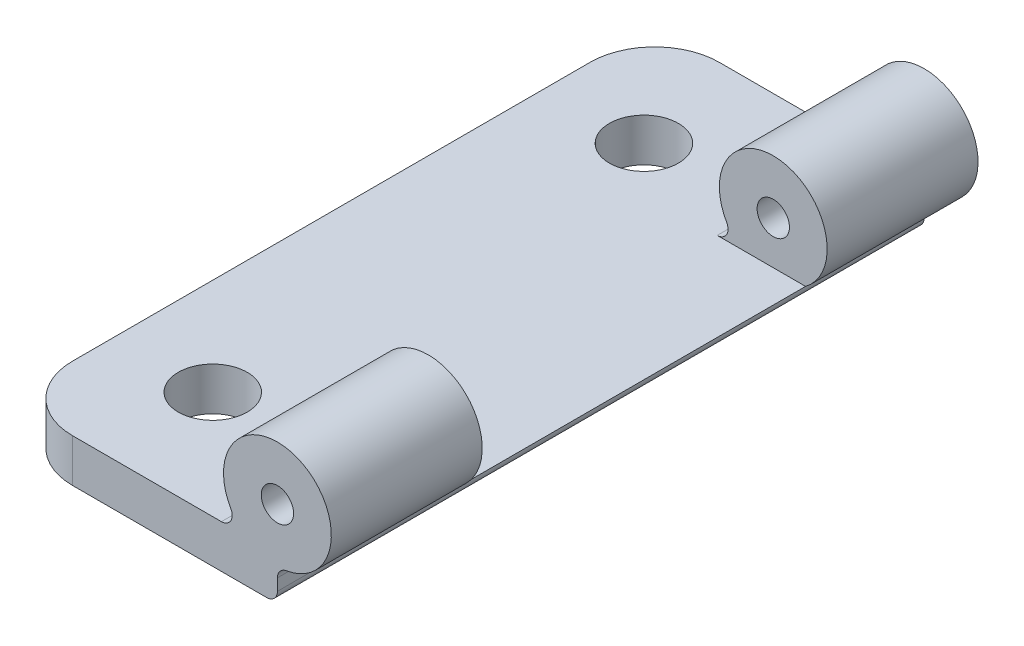
from build123d import *

# Parameters (mm, degrees)
SKETCH_1_R          = 1.6
EXTRUDE_1_DEPTH     = 2
SKETCH_2_R          = 2.5
EXTRUDE_2_DEPTH     = 30
FILLET_1_R          = 0.5
SKETCH_3_R          = 0.75
CUT_EXTRUDE_1_DEPTH = 35.165040612
SKETCH_4_W          = 5.098076211
SKETCH_4_H          = 16
CUT_EXTRUDE_2_DEPTH = 34.841542518


with BuildPart() as part:
    # 草图1 → 凸台-拉伸1 (new body)
    with BuildSketch(Plane(origin=(0, 0, 0), x_dir=(1, 0, 0), z_dir=(0, 1, 0))):
        with BuildLine():
            Line((3, 0), (12.5, 0))
            Line((12.5, 0), (12.5, -30))
            Line((12.5, -30), (3, -30))
            ThreePointArc((3, -30), (0.878679656, -29.121320344), (0, -27))
            Line((0, -27), (0, -3))
            ThreePointArc((0, -3), (0.878679656, -0.878679656), (3, 0))
        make_face()
        with Locations(Location((4.5, -5, 0), (0, 0, 270))):
            Circle(SKETCH_1_R, mode=Mode.SUBTRACT)
        with Locations(Location((4.5, -25, 0), (0, 0, 270))):
            Circle(SKETCH_1_R, mode=Mode.SUBTRACT)
    extrude(amount=EXTRUDE_1_DEPTH)

    # 草图2 → 凸台-拉伸2 (add)
    with BuildSketch(Plane.XY.offset(30)):
        with Locations((12.5, 4)):
            Circle(SKETCH_2_R)
    extrude(amount=-EXTRUDE_2_DEPTH)

    # 圆角1
    fillet_1_edges = [part.edges().sort_by_distance(p)[0] for p in [
        (12.5, 1.5, 15),
        (11, 2, 15),
        (12.5, 0, 15),
    ]]
    fillet(fillet_1_edges, radius=FILLET_1_R)

    # 草图3 → 切除-拉伸1 (cut, through all)
    with BuildSketch(Plane.XY.offset(30)):
        with Locations((12.5, 4)):
            Circle(SKETCH_3_R)
    extrude(amount=-CUT_EXTRUDE_1_DEPTH, mode=Mode.SUBTRACT)

    # 草图4 → 切除-拉伸2 (cut, through all)
    with BuildSketch(Plane(origin=(0, 2, 0), x_dir=(1, 0, 0), z_dir=(0, 1, 0))):
        with Locations((12.450961895, -15)):
            Rectangle(SKETCH_4_W, SKETCH_4_H)
    extrude(amount=CUT_EXTRUDE_2_DEPTH, mode=Mode.SUBTRACT)


solid = part.part
